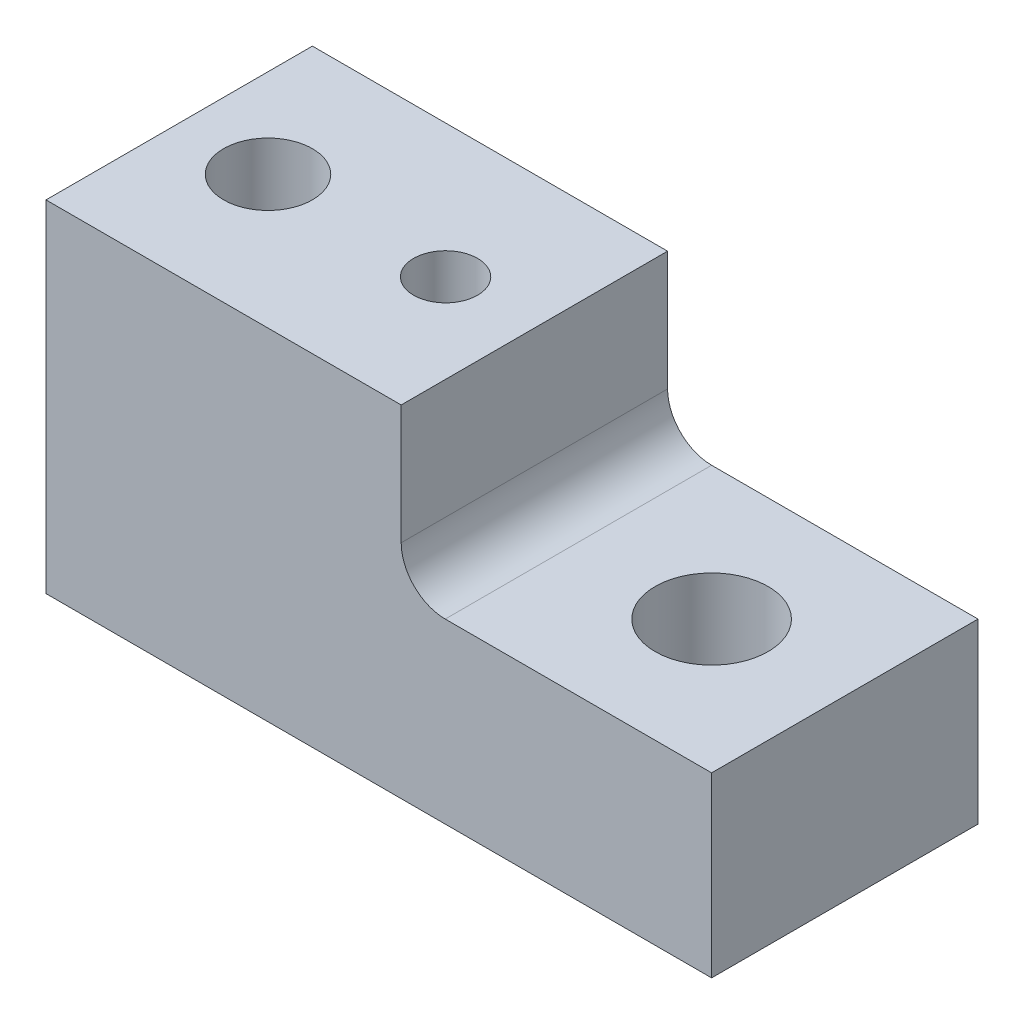
from build123d import *

# Parameters (mm, degrees)
SKETCH1_W                 = 23.7998
SKETCH1_H                 = 9.525
BOSS_EXTRUDE1_DEPTH       = 12.192
SKETCH2_W                 = 11.0998
SKETCH2_H                 = 9.525
CUT_EXTRUDE1_DEPTH        = 5.842
FILLET1_R                 = 1.5748
F_4_40_TAPPED_HOLE5_D     = 2.2606
F_4_40_TAPPED_HOLE5_DEPTH = 6.35
F_4_40_TAPPED_HOLE5_TIP   = 0.679152758
SKETCH4_R                 = 1.5875
SKETCH4_R_2               = 1.143
CUT_EXTRUDE2_DEPTH        = 18.689937543
F_10_32_TAPPED_HOLE1_D    = 4.0386


with BuildPart() as part:
    # Sketch1 → Boss-Extrude1 (new body)
    with BuildSketch(Plane(origin=(0, 0, 0), x_dir=(1, 0, 0), z_dir=(0, 1, 0))):
        Rectangle(SKETCH1_W, SKETCH1_H)
    extrude(amount=BOSS_EXTRUDE1_DEPTH)

    # Sketch2 → Cut-Extrude1 (cut)
    with BuildSketch(Plane(origin=(0, 12.192, 0), x_dir=(1, 0, 0), z_dir=(0, 1, 0))):
        with Locations((6.35, 0)):
            Rectangle(SKETCH2_W, SKETCH2_H)
    extrude(amount=-CUT_EXTRUDE1_DEPTH, mode=Mode.SUBTRACT)

    # Fillet1
    fillet1_edges = [part.edges().sort_by_distance(p)[0] for p in [
        (0.8001, 6.35, 0),
    ]]
    fillet(fillet1_edges, radius=FILLET1_R)

    # #4-40 Tapped Hole5
    with Locations(Plane(origin=(-2.3749, 12.192, 0), x_dir=(0, 0, 1), z_dir=(0, 1, 0))):
        with Locations((0, 0)):
            Hole(F_4_40_TAPPED_HOLE5_D / 2, depth=F_4_40_TAPPED_HOLE5_DEPTH)
            with Locations((0, 0, -(F_4_40_TAPPED_HOLE5_DEPTH + F_4_40_TAPPED_HOLE5_TIP / 2))):  # 118° drill point
                Cone(0, F_4_40_TAPPED_HOLE5_D / 2, F_4_40_TAPPED_HOLE5_TIP, mode=Mode.SUBTRACT)

    # Sketch4 → Cut-Extrude2 (cut, through all)
    with BuildSketch(Plane(origin=(0, 12.192, 0), x_dir=(1, 0, 0), z_dir=(0, 1, 0))):
        with Locations(Location((-8.7249, 0, 0), (0, 0, 270))):
            Circle(SKETCH4_R)
        with Locations(Location((-2.3749, 0, 0), (0, 0, 270))):
            Circle(SKETCH4_R_2)
    extrude(amount=-CUT_EXTRUDE2_DEPTH, mode=Mode.SUBTRACT)

    # #10-32 Tapped Hole1 (through all)
    with Locations(Plane(origin=(0, 6.35, 0), x_dir=(1, 0, 0), z_dir=(0, 1, 0))):
        with Locations((7.1374, 0)):
            Hole(F_10_32_TAPPED_HOLE1_D / 2)


solid = part.part
